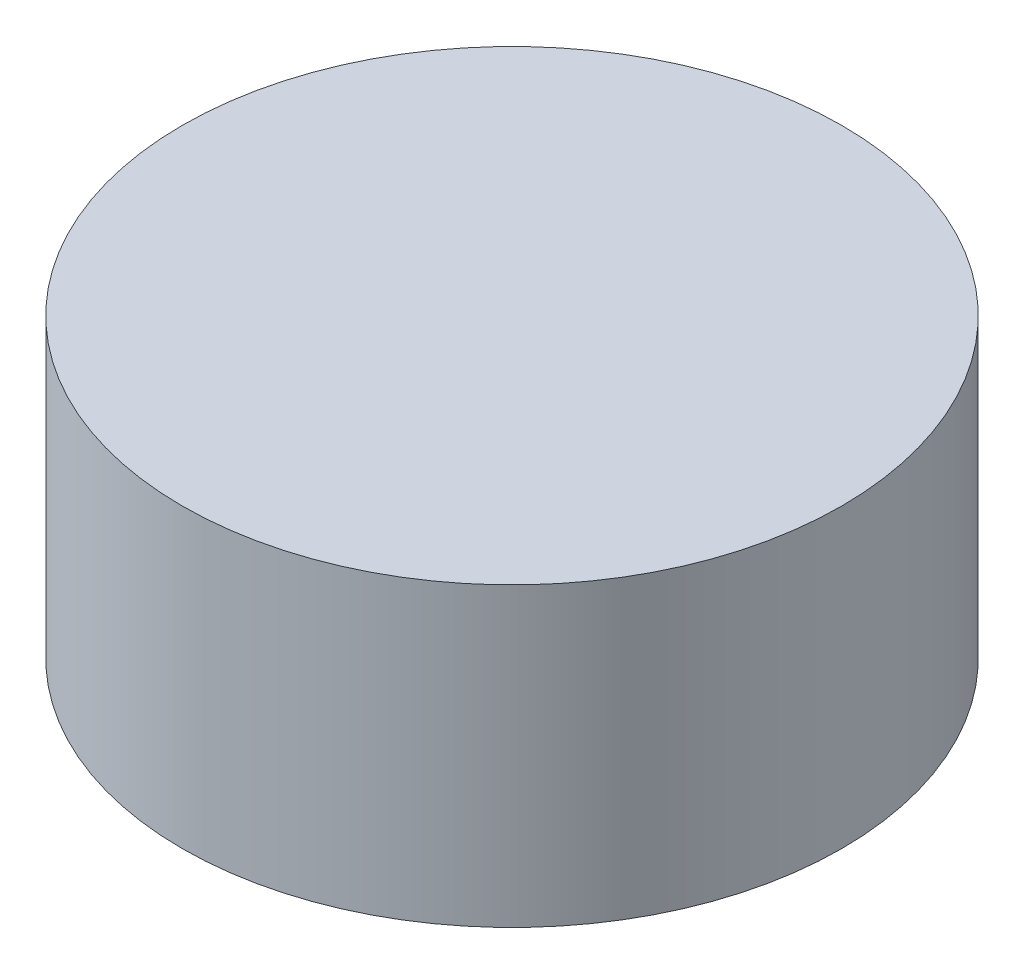
from build123d import *

# Parameters (mm, degrees)
SKETCH1_R                 = 20
VNT_KORUK_DUDAK_D40_DEPTH = 18


with BuildPart() as part:
    # Sketch1 → VNT_koruk_dudak_D40 (new body)
    with BuildSketch(Plane(origin=(0, 0, 0), x_dir=(1, 0, 0), z_dir=(0, 1, 0))):
        with Locations(Location((0, 0, 0), (0, 0, 270))):
            Circle(SKETCH1_R)
    extrude(amount=VNT_KORUK_DUDAK_D40_DEPTH)


solid = part.part
